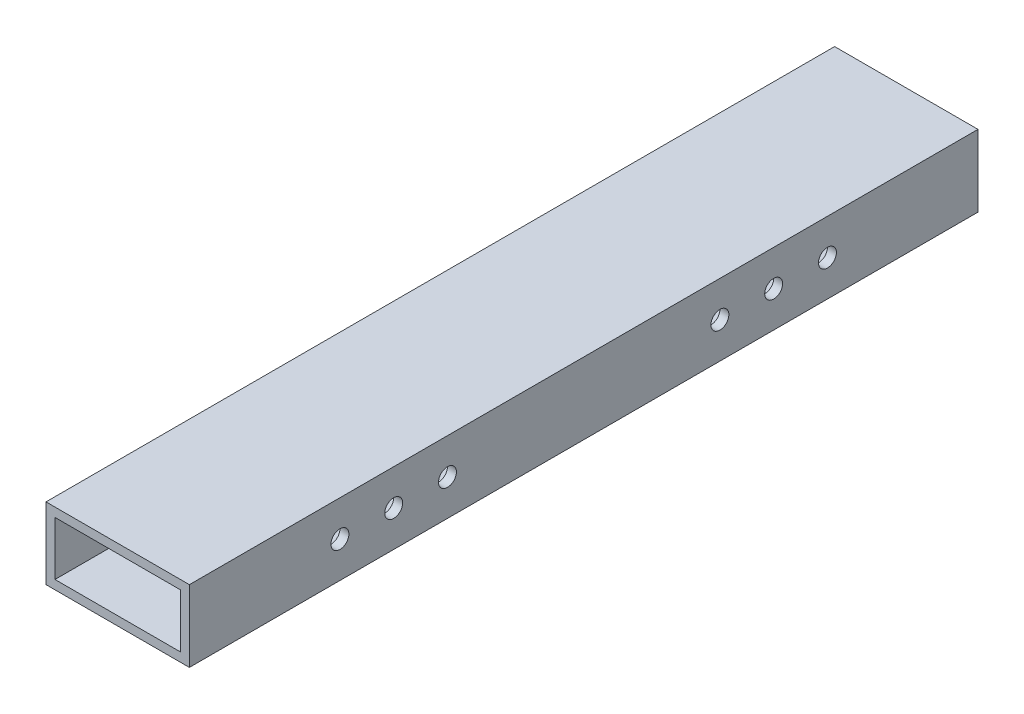
from build123d import *

# Parameters (mm, degrees)
SKETCH1_W           = 50.8
SKETCH1_H           = 25.4
SKETCH1_W_2         = 44.45
SKETCH1_H_2         = 19.05
BOSS_EXTRUDE1_DEPTH = 279.4
SKETCH2_R           = 3.175
CUT_EXTRUDE1_DEPTH  = 286.114292872


with BuildPart() as part:
    # Sketch1 → Boss-Extrude1 (new body)
    with BuildSketch(Plane.XY):
        with Locations((25.4, 12.7)):
            Rectangle(SKETCH1_W, SKETCH1_H)
        with Locations((25.4, 12.7)):
            Rectangle(SKETCH1_W_2, SKETCH1_H_2, mode=Mode.SUBTRACT)
    extrude(amount=BOSS_EXTRUDE1_DEPTH)

    # Sketch2 → Cut-Extrude1 (cut, through all)
    with BuildSketch(Plane(origin=(50.8, 0, 0), x_dir=(0, 0, -1), z_dir=(1, 0, 0))):
        with Locations((-226.06, 12.7)):
            Circle(SKETCH2_R)
        with Locations((-187.96, 12.7)):
            Circle(SKETCH2_R)
        with Locations((-207.01, 12.7)):
            Circle(SKETCH2_R)
        with Locations(Location((-91.44, 12.7, 0), (0, 0, 180))):
            Circle(SKETCH2_R)
        with Locations(Location((-53.34, 12.7, 0), (0, 0, 180))):
            Circle(SKETCH2_R)
        with Locations(Location((-72.39, 12.7, 0), (0, 0, 180))):
            Circle(SKETCH2_R)
    extrude(amount=-CUT_EXTRUDE1_DEPTH, mode=Mode.SUBTRACT)


solid = part.part
